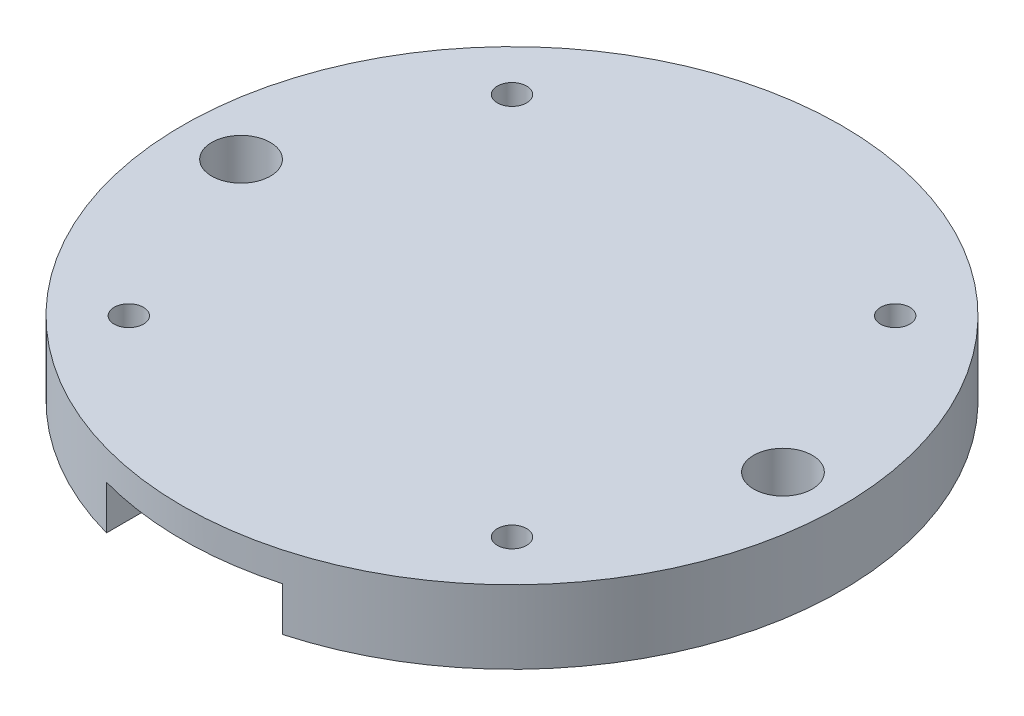
from build123d import *

# Parameters (mm, degrees)
SKETCH_1_R               = 22.5
SKETCH_1_R_2             = 2
EXTRUDE_1_DEPTH          = 5
SKETCH_2_R               = 10.25
CUT_EXTRUDE_1_DEPTH      = 1
CUT_EXTRUDE_2_DEPTH      = 33.210246817
CUT_EXTRUDE_2_DEPTH_BACK = 33.210246817
SKETCH_3_W               = 12
SKETCH_3_H               = 3
SKETCH_4_R               = 1
CUT_EXTRUDE_3_DEPTH      = 33.210246817


with BuildPart() as part:
    # 草图1 → 凸台-拉伸1 (new body)
    with BuildSketch(Plane(origin=(0, 0, 0), x_dir=(1, 0, 0), z_dir=(0, 1, 0))):
        with Locations(Location((0, 0, 0), (0, 0, 270))):
            Circle(SKETCH_1_R)
        with Locations(Location((18.5, 0, 0), (0, 0, 270))):
            Circle(SKETCH_1_R_2, mode=Mode.SUBTRACT)
        with Locations(Location((-18.5, 0, 0), (0, 0, 90))):
            Circle(SKETCH_1_R_2, mode=Mode.SUBTRACT)
    extrude(amount=EXTRUDE_1_DEPTH)

    # 草图2 → 切除-拉伸1 (cut)
    with BuildSketch(Plane(origin=(0, 0, 0), x_dir=(1, 0, 0), z_dir=(0, 1, 0))):
        with Locations(Location((0, 0, 0), (0, 0, 270))):
            Circle(SKETCH_2_R)
    extrude(amount=CUT_EXTRUDE_1_DEPTH, mode=Mode.SUBTRACT)

    # 草图3 → 切除-拉伸2 (cut, two sides: drawn at the far end of the back side and taken through both)
    with BuildSketch(Plane.XY.offset(-CUT_EXTRUDE_2_DEPTH_BACK)):
        with Locations((0, 1.5)):
            Rectangle(SKETCH_3_W, SKETCH_3_H)
    extrude(amount=CUT_EXTRUDE_2_DEPTH + CUT_EXTRUDE_2_DEPTH_BACK, mode=Mode.SUBTRACT)

    # 草图4 → 切除-拉伸3 (cut, through all)
    with BuildSketch(Plane(origin=(0, 5, 0), x_dir=(1, 0, 0), z_dir=(0, 1, 0))):
        with Locations(Location((13.081475452, 13.081475452, 0), (0, 0, 270))):
            Circle(SKETCH_4_R)
        with Locations(Location((13.081475452, -13.081475452, 0), (0, 0, 270))):
            Circle(SKETCH_4_R)
        with Locations(Location((-13.081475452, 13.081475452, 0), (0, 0, 270))):
            Circle(SKETCH_4_R)
        with Locations(Location((-13.081475452, -13.081475452, 0), (0, 0, 270))):
            Circle(SKETCH_4_R)
    extrude(amount=-CUT_EXTRUDE_3_DEPTH, mode=Mode.SUBTRACT)


solid = part.part
